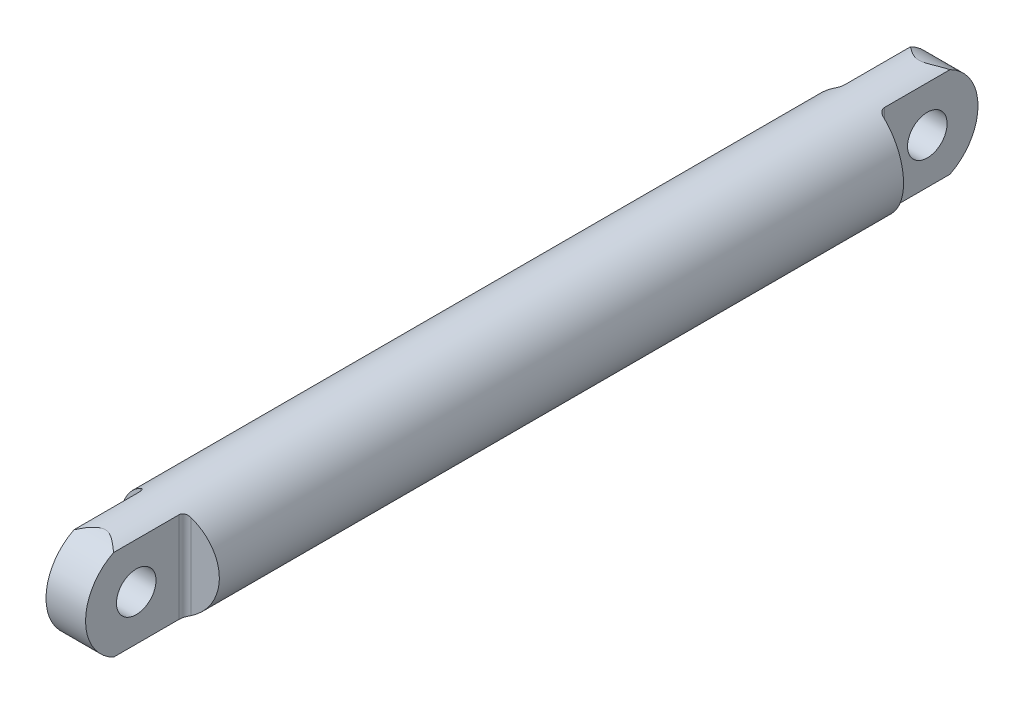
from build123d import *

# Parameters (mm, degrees)
SKETCH1_R            = 7.5
BOSS_EXTRUDE1_DEPTH  = 67.685
CUT_EXTRUDE2_DEPTH   = 69.511015355
CUT_EXTRUDE3_DEPTH   = 69.511015476
SKETCH8_R            = 3
CUT_EXTRUDE4_DEPTH   = 69.903985677
FILLET1_R            = 1
FILLET1_OF_MIRROR2_R = 1


with BuildPart() as part:
    # Sketch1 → Boss-Extrude1 (new, symmetric)
    with BuildSketch(Plane.XY):
        Circle(SKETCH1_R)
    extrude(amount=BOSS_EXTRUDE1_DEPTH, both=True)

    # Sketch6 → Cut-Extrude2 (cut, symmetric)
    with BuildSketch(Plane(origin=(0, 0, 0), x_dir=(0, 0, -1), z_dir=(1, 0, 0))):
        with BuildLine():
            Line((67.685, 0), (67.685, 7.5))
            Line((67.685, 7.5), (61.685, 7.5))
            ThreePointArc((61.685, 7.5), (66.000428973, 4.802343178), (67.685, 0))
        make_face()
        with BuildLine():
            Line((67.685, -7.5), (67.685, 0))
            ThreePointArc((67.685, 0), (66.000428973, -4.802343178), (61.685, -7.5))
            Line((61.685, -7.5), (67.685, -7.5))
        make_face()
    cut_extrude2 = extrude(amount=CUT_EXTRUDE2_DEPTH, both=True, mode=Mode.SUBTRACT)

    # Sketch7 → Cut-Extrude3 (cut, symmetric)
    with BuildSketch(Plane(origin=(0, 0, 0), x_dir=(1, 0, 0), z_dir=(0, 1, 0))):
        Polygon((-3, 67.685), (-3, 52.685), (-7.5, 51.891528587), (-7.5, 67.685), align=None)
        Polygon((7.5, 67.685), (3, 67.685), (3, 52.685), (7.5, 51.891528587), align=None)
    cut_extrude3 = extrude(amount=CUT_EXTRUDE3_DEPTH, both=True, mode=Mode.SUBTRACT)

    # Sketch8 → Cut-Extrude4 (cut, symmetric)
    with BuildSketch(Plane(origin=(-3, 0, 0), x_dir=(0, 0, -1), z_dir=(1, 0, 0))):
        with Locations((59.9975, 0)):
            Circle(SKETCH8_R)
    cut_extrude4 = extrude(amount=CUT_EXTRUDE4_DEPTH, both=True, mode=Mode.SUBTRACT)

    # Fillet1
    fillet1_edges = [part.edges().sort_by_distance(p)[0] for p in [
        (-3, 0, -52.685),
        (3, 0, -52.685),
    ]]
    fillet(fillet1_edges, radius=FILLET1_R)

    # Mirror2: Cut-Extrude2, Cut-Extrude3, Cut-Extrude4 across plane
    add(cut_extrude2.mirror(Plane.XY), mode=Mode.SUBTRACT)
    add(cut_extrude3.mirror(Plane.XY), mode=Mode.SUBTRACT)
    add(cut_extrude4.mirror(Plane.XY), mode=Mode.SUBTRACT)

    # Fillet1 of Mirror2
    fillet1_of_mirror2_edges = [part.edges().sort_by_distance(p)[0] for p in [
        (-3, 0, 52.685),
        (3, 0, 52.685),
    ]]
    fillet(fillet1_of_mirror2_edges, radius=FILLET1_OF_MIRROR2_R)


solid = part.part
